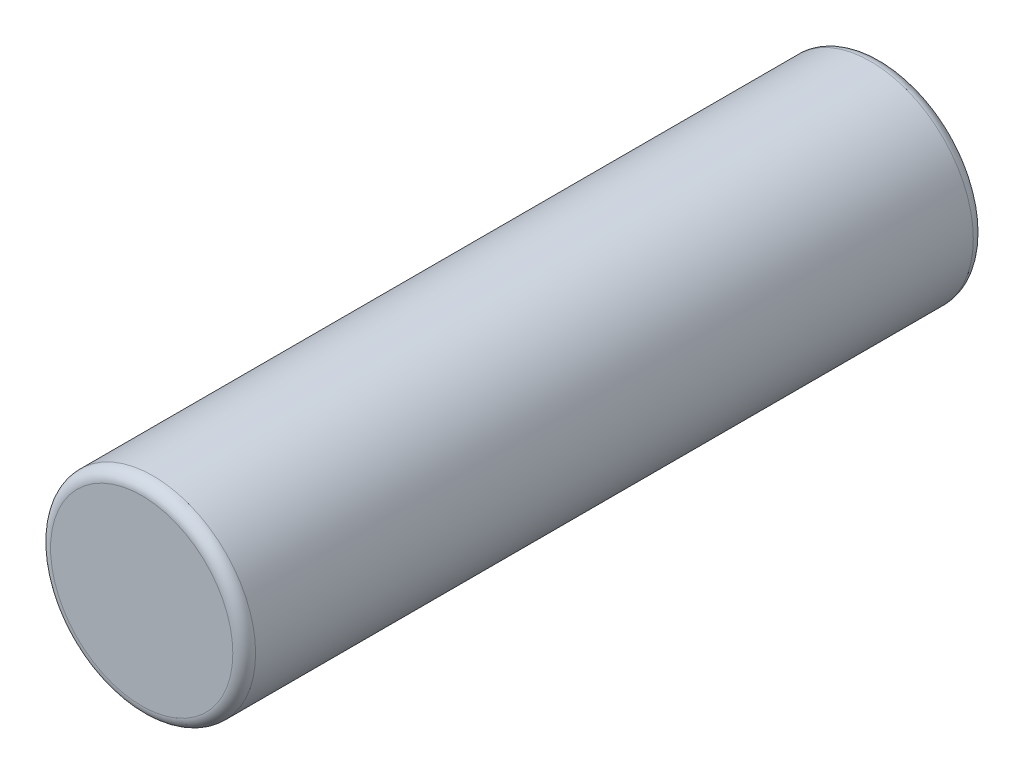
from build123d import *

# Parameters (mm, degrees)
ESBO_O1_R                = 9
RESSALTO_EXTRUS_O1_DEPTH = 65
FILETE2_R                = 1


with BuildPart() as part:
    # Esboço1 → Ressalto-extrusão1 (new body)
    with BuildSketch(Plane.XY):
        Circle(ESBO_O1_R)
    extrude(amount=RESSALTO_EXTRUS_O1_DEPTH)

    # Filete2
    filete2_edges = [part.edges().sort_by_distance(p)[0] for p in [
        (-9, 0, 0),
        (-9, 0, 65),
    ]]
    fillet(filete2_edges, radius=FILETE2_R)


solid = part.part
